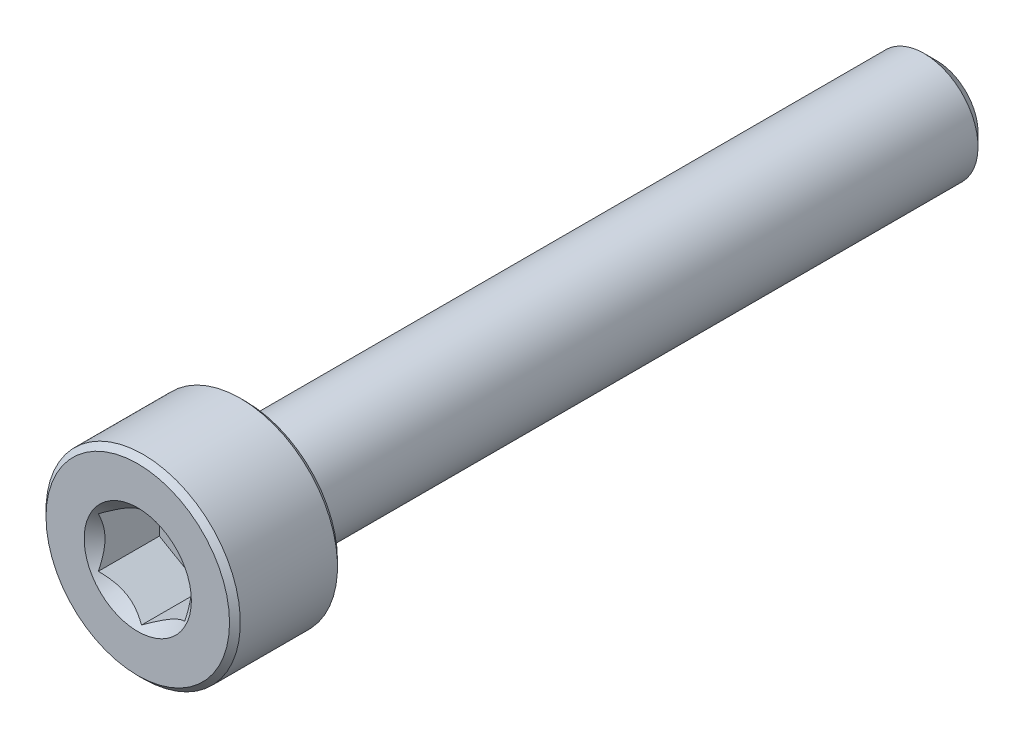
from build123d import *

# Parameters (mm, degrees)
CUT_EXTRUDE1_DEPTH     = 1.5
SPLIT1_SURFACE_1_BACK  = 20.564
SPLIT1_SURFACE_1_DEPTH = 41.128
SPLIT1_SURFACE_2_BACK  = 20.564
SPLIT1_SURFACE_2_DEPTH = 41.128


with BuildPart() as part:
    # Sketch2 → Revolve1 (revolve)
    with BuildSketch(Plane(origin=(0, 0, 0), x_dir=(0, 0, -1), z_dir=(1, 0, 0))):
        with BuildLine():
            Line((-9.25, 0), (-9.25, 2.125))
            Line((-9.25, 2.125), (-9.125, 2.25))
            Line((-9.125, 2.25), (-6.875, 2.25))
            Line((-6.875, 2.25), (-6.75, 2.125))
            Line((-6.75, 2.125), (-6.75, 1.375))
            ThreePointArc((-6.75, 1.375), (-6.713388348, 1.286611652), (-6.625, 1.25))
            Line((-6.625, 1.25), (8.957716426, 1.25))
            Line((8.957716426, 1.25), (9.25, 0.957716426))
            Line((9.25, 0.957716426), (9.25, 0))
            Line((9.25, 0), (-9.25, 0))
        make_face()
    revolve(axis=Axis((0, 0, -9.25), (0, 0, 1)))

    # Sketch3 → Cut-Extrude1 (cut)
    with BuildSketch(Plane.XY.offset(9.25)):
        Polygon((1, -0.577350269), (1, 0.577350269), (0, 1.154700538), (-1, 0.577350269), (-1, -0.577350269), (0, -1.154700538), align=None)
    extrude(amount=-CUT_EXTRUDE1_DEPTH, mode=Mode.SUBTRACT)

    # Cut-Extrude2 cone 1 section (through the dimple's axis) → Cut-Extrude2 (revolve, cut)
    with BuildSketch(Plane(origin=(0, 0, 9.25), x_dir=(0, -1, 0), z_dir=(1, 0, 0))):
        Polygon((0, 0), (1.241303079, 0), (0, 1.241303079), align=None)
    revolve(axis=Axis((0, 0, 9.25), (0, 0, -1)), mode=Mode.SUBTRACT)


with BuildPart() as body_2:
    # Split1: the piece behind the surface
    add(part.part)
    # Split1 surface: a surface, the sketch's curves swept straight by 41.128 mm
    with BuildLine(Plane(origin=(0, 0, 0), x_dir=(0, 0, -1), z_dir=(1, 0, 0)).offset(-SPLIT1_SURFACE_1_BACK), mode=Mode.PRIVATE) as split1_surface_1_path:
        Line((-6.625, -2.25), (-6.625, 2.25))
    split1_surface_1 = Shell.extrude(split1_surface_1_path.wire(), (1 * SPLIT1_SURFACE_1_DEPTH, 0 * SPLIT1_SURFACE_1_DEPTH, 0 * SPLIT1_SURFACE_1_DEPTH))
    split(bisect_by=split1_surface_1, keep=Keep.BOTTOM)


with BuildPart() as part_1:
    add(part.part)

    # Split1: split by a surface, the side it looks to stays
    # Split1 surface: a surface, the sketch's curves swept straight by 41.128 mm
    with BuildLine(Plane(origin=(0, 0, 0), x_dir=(0, 0, -1), z_dir=(1, 0, 0)).offset(-SPLIT1_SURFACE_2_BACK), mode=Mode.PRIVATE) as split1_surface_2_path:
        Line((-6.625, -2.25), (-6.625, 2.25))
    split1_surface_2 = Shell.extrude(split1_surface_2_path.wire(), (1 * SPLIT1_SURFACE_2_DEPTH, 0 * SPLIT1_SURFACE_2_DEPTH, 0 * SPLIT1_SURFACE_2_DEPTH))
    split(bisect_by=split1_surface_2, keep=Keep.TOP)

    # Sketch8 → Revolve2 (revolve)
    with BuildSketch(Plane(origin=(0, 0, 0), x_dir=(0, 0, -1), z_dir=(1, 0, 0)), mode=Mode.PRIVATE) as revolve2_sk:
        Polygon((-6.75, 0), (-6.75, 1.25), (-6.625, 1.25), (-5.903312164, 0), align=None)
    revolve(revolve2_sk.sketch.rotate(Axis((0, 0, 5.903312164), (0, 0, 1)), 270), axis=Axis((0, 0, 5.903312164), (0, 0, 1)))


solid = Compound([body_2.part, part_1.part])
